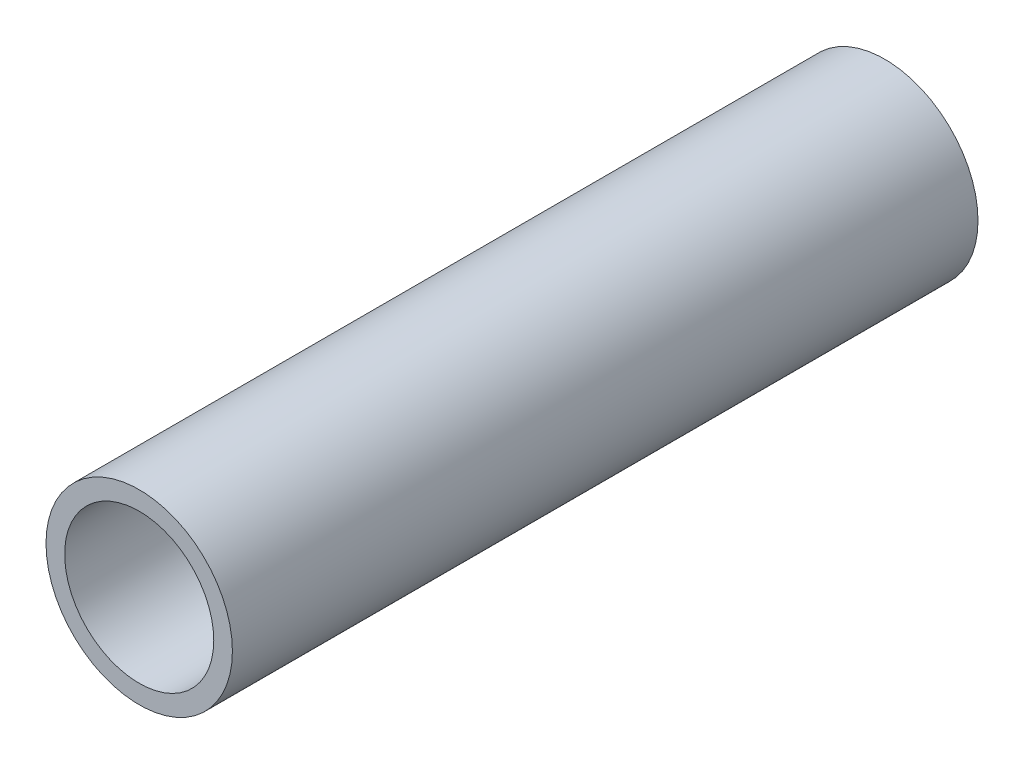
from build123d import *

# Parameters (mm, degrees)
SKETCH_1_R      = 5
SKETCH_1_R_2    = 4
EXTRUDE_1_DEPTH = 40


with BuildPart() as part:
    # ｽｹｯﾁ1 → ﾎﾞｽ - 押し出し1 (new body)
    with BuildSketch(Plane.XY):
        Circle(SKETCH_1_R)
        Circle(SKETCH_1_R_2, mode=Mode.SUBTRACT)
    extrude(amount=EXTRUDE_1_DEPTH)


solid = part.part
